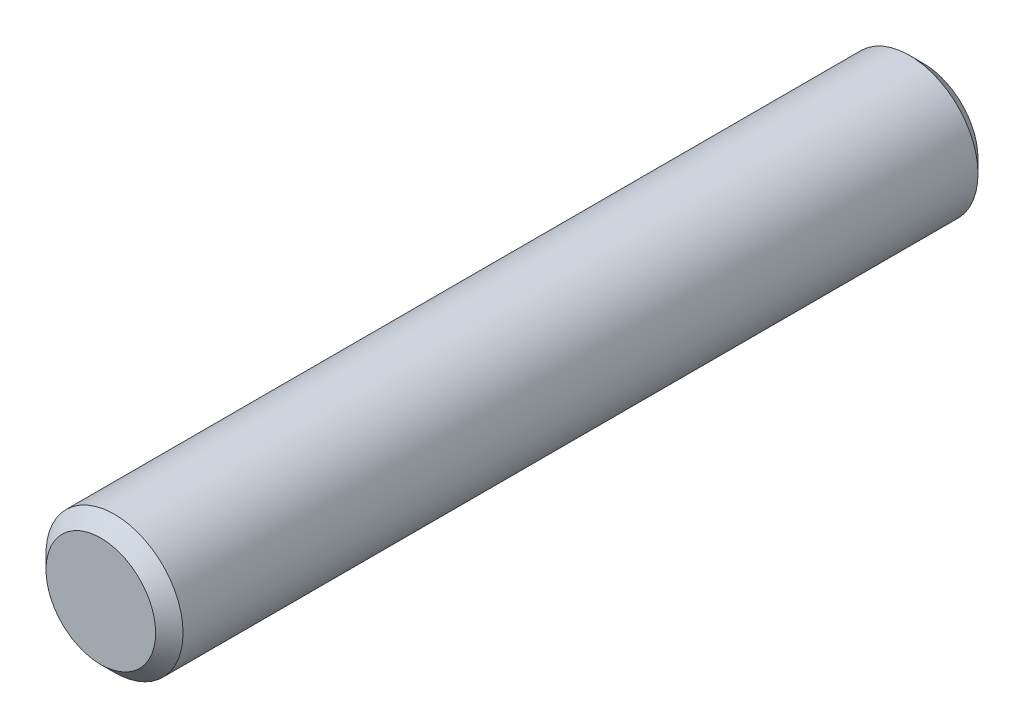
from build123d import *

# Parameters (mm, degrees)
SKETCH_1_R      = 5
EXTRUDE_1_DEPTH = 60
CHAMFER_1_SIZE  = 1


with BuildPart() as part:
    # Эскиз1 → Бобышка-Вытянуть1 (new body)
    with BuildSketch(Plane.XY):
        Circle(SKETCH_1_R)
    extrude(amount=EXTRUDE_1_DEPTH)

    # Фаска1
    chamfer_1_edges = [part.edges().sort_by_distance(p)[0] for p in [
        (-5, 0, 0),
        (-5, 0, 60),
    ]]
    chamfer(chamfer_1_edges, length=CHAMFER_1_SIZE)


solid = part.part
